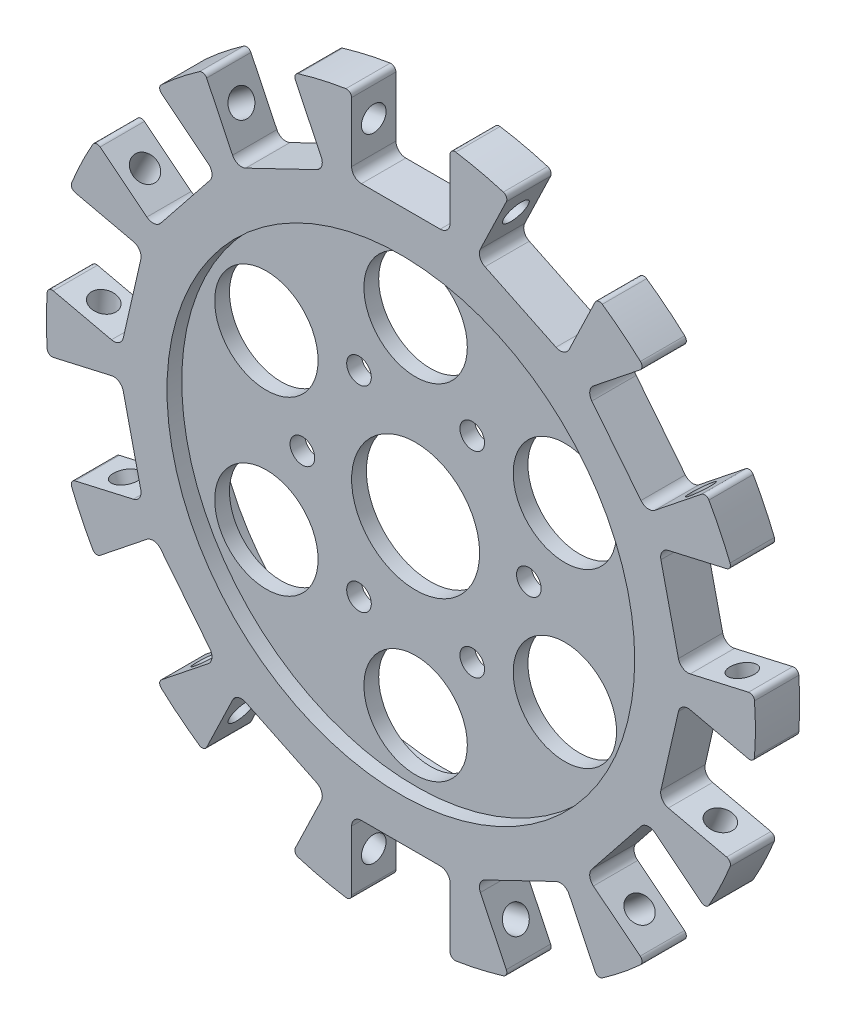
from build123d import *

# Parameters (mm, degrees)
EXTRUDE_1_DEPTH     = 4.5
FILLET_1_R          = 1
SKETCH_2_R          = 47.5
CUT_EXTRUDE_2_DEPTH = 3
CUT_EXTRUDE_START   = -3
SKETCH_3_R          = 47.5
CUT_EXTRUDE_3_DEPTH = 3
SKETCH_4_R          = 13
SKETCH_4_R_2        = 10.5
CUT_EXTRUDE_4_DEPTH = 102.396673631
SKETCH_5_R          = 2.5
CUT_EXTRUDE_5_DEPTH = 102.396673631
SKETCH_7_R          = 2.5


with BuildPart() as part:
    # 草图1 → 拉伸1 (new, symmetric)
    with BuildSketch(Plane.XY):
        with BuildLine():
            Line((-10, 58), (-10, 71.30217388))
            ThreePointArc((-10, 71.30217388), (-16.021507245, 70.194809677), (-21.927165131, 68.579876271))
            Line((-21.927165131, 68.579876271), (-16.15556819, 56.59503173))
            ThreePointArc((-16.15556819, 56.59503173), (-16.069739265, 55.066706127), (-17.089738447, 53.925326515))
            Line((-17.089738447, 53.925326515), (-24.297489391, 50.454256603))
            Line((-24.297489391, 50.454256603), (-31.505240334, 46.98318669))
            ThreePointArc((-31.505240334, 46.98318669), (-33.033565936, 46.897357765), (-34.174945548, 47.917356947))
            Line((-34.174945548, 47.917356947), (-39.946542489, 59.902201488))
            ThreePointArc((-39.946542489, 59.902201488), (-44.891265734, 56.291866738), (-49.511386289, 52.274493089))
            Line((-49.511386289, 52.274493089), (-39.111327965, 43.980723332))
            ThreePointArc((-39.111327965, 43.980723332), (-38.370883148, 42.64098932), (-38.794644603, 41.170080764))
            Line((-38.794644603, 41.170080764), (-43.782563018, 34.915428904))
            Line((-43.782563018, 34.915428904), (-48.770481433, 28.660777044))
            ThreePointArc((-48.770481433, 28.660777044), (-50.110215446, 27.920332228), (-51.581124002, 28.344093683))
            Line((-51.581124002, 28.344093683), (-61.981182326, 36.63786344))
            ThreePointArc((-61.981182326, 36.63786344), (-64.869758489, 31.239629216), (-67.289270175, 25.615505447))
            Line((-67.289270175, 25.615505447), (-54.320609567, 22.655493291))
            ThreePointArc((-54.320609567, 22.655493291), (-53.072203036, 21.76970162), (-52.815795611, 20.260595599))
            Line((-52.815795611, 20.260595599), (-54.595963082, 12.461172302))
            Line((-54.595963082, 12.461172302), (-56.376130554, 4.661749004))
            ThreePointArc((-56.376130554, 4.661749004), (-57.261922225, 3.413342474), (-58.771028246, 3.156935048))
            Line((-58.771028246, 3.156935048), (-71.739688854, 6.116947203))
            ThreePointArc((-71.739688854, 6.116947203), (-72, 0), (-71.739688854, -6.116947203))
            Line((-71.739688854, -6.116947203), (-58.771028246, -3.156935048))
            ThreePointArc((-58.771028246, -3.156935048), (-57.261922225, -3.413342474), (-56.376130554, -4.661749004))
            Line((-56.376130554, -4.661749004), (-54.595963082, -12.461172302))
            Line((-54.595963082, -12.461172302), (-52.815795611, -20.260595599))
            ThreePointArc((-52.815795611, -20.260595599), (-53.072203036, -21.76970162), (-54.320609567, -22.655493291))
            Line((-54.320609567, -22.655493291), (-67.289270175, -25.615505447))
            ThreePointArc((-67.289270175, -25.615505447), (-64.869758489, -31.239629216), (-61.981182326, -36.63786344))
            Line((-61.981182326, -36.63786344), (-51.581124002, -28.344093683))
            ThreePointArc((-51.581124002, -28.344093683), (-50.110215446, -27.920332228), (-48.770481433, -28.660777044))
            Line((-48.770481433, -28.660777044), (-43.782563018, -34.915428904))
            Line((-43.782563018, -34.915428904), (-38.794644603, -41.170080764))
            ThreePointArc((-38.794644603, -41.170080764), (-38.370883148, -42.64098932), (-39.111327965, -43.980723332))
            Line((-39.111327965, -43.980723332), (-49.511386289, -52.274493089))
            ThreePointArc((-49.511386289, -52.274493089), (-44.891265734, -56.291866738), (-39.946542489, -59.902201488))
            Line((-39.946542489, -59.902201488), (-34.174945548, -47.917356947))
            ThreePointArc((-34.174945548, -47.917356947), (-33.033565936, -46.897357765), (-31.505240334, -46.98318669))
            Line((-31.505240334, -46.98318669), (-24.297489391, -50.454256603))
            Line((-24.297489391, -50.454256603), (-17.089738447, -53.925326515))
            ThreePointArc((-17.089738447, -53.925326515), (-16.069739265, -55.066706127), (-16.15556819, -56.59503173))
            Line((-16.15556819, -56.59503173), (-21.927165131, -68.579876271))
            ThreePointArc((-21.927165131, -68.579876271), (-16.021507245, -70.194809677), (-10, -71.30217388))
            Line((-10, -71.30217388), (-10, -58))
            ThreePointArc((-10, -58), (-9.414213562, -56.585786438), (-8, -56))
            Line((-8, -56), (0, -56))
            Line((0, -56), (8, -56))
            ThreePointArc((8, -56), (9.414213562, -56.585786438), (10, -58))
            Line((10, -58), (10, -71.30217388))
            ThreePointArc((10, -71.30217388), (16.021507245, -70.194809677), (21.927165131, -68.579876271))
            Line((21.927165131, -68.579876271), (16.15556819, -56.59503173))
            ThreePointArc((16.15556819, -56.59503173), (16.069739265, -55.066706127), (17.089738447, -53.925326515))
            Line((17.089738447, -53.925326515), (24.297489391, -50.454256603))
            Line((24.297489391, -50.454256603), (31.505240334, -46.98318669))
            ThreePointArc((31.505240334, -46.98318669), (33.033565936, -46.897357765), (34.174945548, -47.917356947))
            Line((34.174945548, -47.917356947), (39.946542489, -59.902201488))
            ThreePointArc((39.946542489, -59.902201488), (44.891265734, -56.291866738), (49.511386289, -52.274493089))
            Line((49.511386289, -52.274493089), (39.111327965, -43.980723332))
            ThreePointArc((39.111327965, -43.980723332), (38.370883148, -42.64098932), (38.794644603, -41.170080764))
            Line((38.794644603, -41.170080764), (43.782563018, -34.915428904))
            Line((43.782563018, -34.915428904), (48.770481433, -28.660777044))
            ThreePointArc((48.770481433, -28.660777044), (50.110215446, -27.920332228), (51.581124002, -28.344093683))
            Line((51.581124002, -28.344093683), (61.981182326, -36.63786344))
            ThreePointArc((61.981182326, -36.63786344), (64.869758489, -31.239629216), (67.289270175, -25.615505447))
            Line((67.289270175, -25.615505447), (54.320609567, -22.655493291))
            ThreePointArc((54.320609567, -22.655493291), (53.072203036, -21.76970162), (52.815795611, -20.260595599))
            Line((52.815795611, -20.260595599), (54.595963082, -12.461172302))
            Line((54.595963082, -12.461172302), (56.376130554, -4.661749004))
            ThreePointArc((56.376130554, -4.661749004), (57.261922225, -3.413342474), (58.771028246, -3.156935048))
            Line((58.771028246, -3.156935048), (71.739688854, -6.116947203))
            ThreePointArc((71.739688854, -6.116947203), (72, 0), (71.739688854, 6.116947203))
            Line((71.739688854, 6.116947203), (58.771028246, 3.156935048))
            ThreePointArc((58.771028246, 3.156935048), (57.261922225, 3.413342474), (56.376130554, 4.661749004))
            Line((56.376130554, 4.661749004), (54.595963082, 12.461172302))
            Line((54.595963082, 12.461172302), (52.815795611, 20.260595599))
            ThreePointArc((52.815795611, 20.260595599), (53.072203036, 21.76970162), (54.320609567, 22.655493291))
            Line((54.320609567, 22.655493291), (67.289270175, 25.615505447))
            ThreePointArc((67.289270175, 25.615505447), (64.869758489, 31.239629216), (61.981182326, 36.63786344))
            Line((61.981182326, 36.63786344), (51.581124002, 28.344093683))
            ThreePointArc((51.581124002, 28.344093683), (50.110215446, 27.920332228), (48.770481433, 28.660777044))
            Line((48.770481433, 28.660777044), (43.782563018, 34.915428904))
            Line((43.782563018, 34.915428904), (38.794644603, 41.170080764))
            ThreePointArc((38.794644603, 41.170080764), (38.370883148, 42.64098932), (39.111327965, 43.980723332))
            Line((39.111327965, 43.980723332), (49.511386289, 52.274493089))
            ThreePointArc((49.511386289, 52.274493089), (44.891265734, 56.291866738), (39.946542489, 59.902201488))
            Line((39.946542489, 59.902201488), (34.174945548, 47.917356947))
            ThreePointArc((34.174945548, 47.917356947), (33.033565936, 46.897357765), (31.505240334, 46.98318669))
            Line((31.505240334, 46.98318669), (24.297489391, 50.454256603))
            Line((24.297489391, 50.454256603), (17.089738447, 53.925326515))
            ThreePointArc((17.089738447, 53.925326515), (16.069739265, 55.066706127), (16.15556819, 56.59503173))
            Line((16.15556819, 56.59503173), (21.927165131, 68.579876271))
            ThreePointArc((21.927165131, 68.579876271), (16.021507245, 70.194809677), (10, 71.30217388))
            Line((10, 71.30217388), (10, 58))
            ThreePointArc((10, 58), (9.414213562, 56.585786438), (8, 56))
            Line((8, 56), (0, 56))
            Line((0, 56), (-8, 56))
            ThreePointArc((-8, 56), (-9.414213562, 56.585786438), (-10, 58))
        make_face()
    extrude(amount=EXTRUDE_1_DEPTH, both=True)

    # 圆角1
    fillet_1_edges = [part.edges().sort_by_distance(p)[0] for p in [
        (10, 71.30217388, 0),
        (21.927165131, 68.579876271, 0),
        (39.946542489, 59.902201488, 0),
        (49.511386289, 52.274493089, 0),
        (61.981182326, 36.63786344, 0),
        (67.289270175, 25.615505447, 0),
        (71.739688854, 6.116947203, 0),
        (71.739688854, -6.116947203, 0),
        (67.289270175, -25.615505447, 0),
        (61.981182326, -36.63786344, 0),
        (49.511386289, -52.274493089, 0),
        (39.946542489, -59.902201488, 0),
        (21.927165131, -68.579876271, 0),
        (10, -71.30217388, 0),
        (-10, -71.30217388, 0),
        (-21.927165131, -68.579876271, 0),
        (-39.946542489, -59.902201488, 0),
        (-49.511386289, -52.274493089, 0),
        (-61.981182326, -36.63786344, 0),
        (-67.289270175, -25.615505447, 0),
        (-71.739688854, -6.116947203, 0),
        (-71.739688854, 6.116947203, 0),
        (-67.289270175, 25.615505447, 0),
        (-61.981182326, 36.63786344, 0),
        (-49.511386289, 52.274493089, 0),
        (-39.946542489, 59.902201488, 0),
        (-21.927165131, 68.579876271, 0),
        (-10, 71.30217388, 0),
    ]]
    fillet(fillet_1_edges, radius=FILLET_1_R)

    # 草图2 → 拉伸2 (cut)
    with BuildSketch(Plane.XY.offset(4.5)):
        Circle(SKETCH_2_R)
    extrude(amount=-CUT_EXTRUDE_2_DEPTH, mode=Mode.SUBTRACT)

    # 草图3 → 拉伸3 (cut)
    with BuildSketch(Plane(origin=(0, 0, -4.5), x_dir=(-1, 0, 0), z_dir=(0, 0, -1)).offset(CUT_EXTRUDE_START)):
        with Locations(Location((0, 0, 0), (0, 0, 180))):
            Circle(SKETCH_3_R)
    extrude(amount=CUT_EXTRUDE_3_DEPTH, mode=Mode.SUBTRACT)

    # 草图4 → 拉伸4 (cut, through all)
    with BuildSketch(Plane.XY.offset(1.5)):
        Circle(SKETCH_4_R)
        with Locations((0, 35)):
            Circle(SKETCH_4_R_2)
        with Locations((30.311389132, 17.500866025)):
            Circle(SKETCH_4_R_2)
        with Locations((30.312389132, -17.499133975)):
            Circle(SKETCH_4_R_2)
        with Locations((0.002, -35)):
            Circle(SKETCH_4_R_2)
        with Locations((-30.309389132, -17.500866025)):
            Circle(SKETCH_4_R_2)
        with Locations((-30.310389132, 17.499133975)):
            Circle(SKETCH_4_R_2)
    extrude(amount=-CUT_EXTRUDE_4_DEPTH, mode=Mode.SUBTRACT)

    # 草图5 → 拉伸5 (cut, through all)
    with BuildSketch(Plane.XY.offset(1.5)):
        with Locations((-11.5, 19.918584287)):
            Circle(SKETCH_5_R)
        with Locations((11.5, 19.918584287)):
            Circle(SKETCH_5_R)
        with Locations((23, 0)):
            Circle(SKETCH_5_R)
        with Locations((11.5, -19.918584287)):
            Circle(SKETCH_5_R)
        with Locations((-11.5, -19.918584287)):
            Circle(SKETCH_5_R)
        with Locations((-23, 0)):
            Circle(SKETCH_5_R)
    extrude(amount=-CUT_EXTRUDE_5_DEPTH, mode=Mode.SUBTRACT)

    # 切除-扫描1: sweep along a path in 草图6
    with BuildLine(Plane.XY) as sweep_1_path:
        CenterArc((0, 0), 65, 0, 360)
    # 草图7 → 切除-扫描1 (sweep, cut)
    with BuildSketch(Plane(origin=(0, 0, 0), x_dir=(1, 0, 0), z_dir=(0, 1, 0))):
        with Locations((-65, 0)):
            Circle(SKETCH_7_R)
    sweep(path=sweep_1_path.line, mode=Mode.SUBTRACT)


solid = part.part
